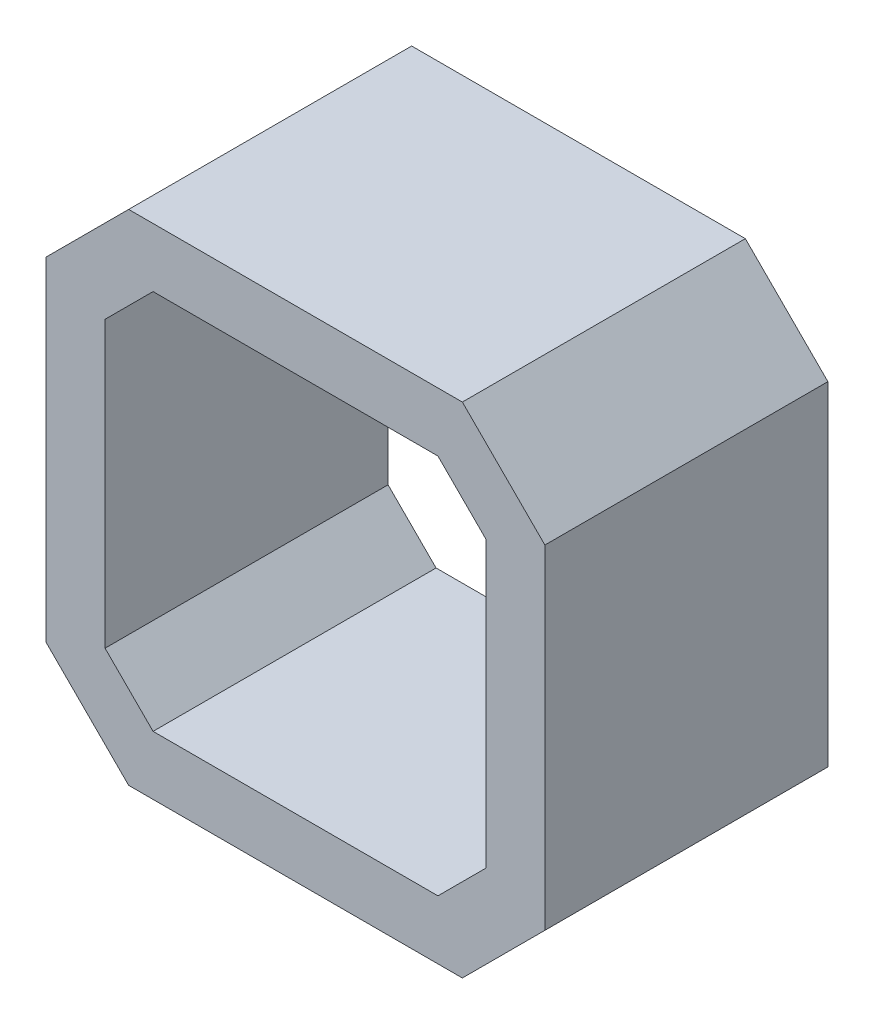
from build123d import *

# Parameters (mm, degrees)
BOSS_EXTRU_1_DEPTH = 24


with BuildPart() as part:
    # Esquisse1 → Boss.-Extru.1 (new body)
    with BuildSketch(Plane.XY):
        Polygon((14.15, 21.15), (21.15, 14.15), (21.15, -14.15), (14.15, -21.15), (-14.15, -21.15), (-21.15, -14.15), (-21.15, 14.15), (-14.15, 21.15), align=None)
        Polygon((-12.078932188, 16.15), (12.078932188, 16.15), (16.15, 12.078932188), (16.15, -12.078932188), (12.078932188, -16.15), (-12.078932188, -16.15), (-16.15, -12.078932188), (-16.15, 12.078932188), align=None, mode=Mode.SUBTRACT)
    extrude(amount=BOSS_EXTRU_1_DEPTH)


solid = part.part
